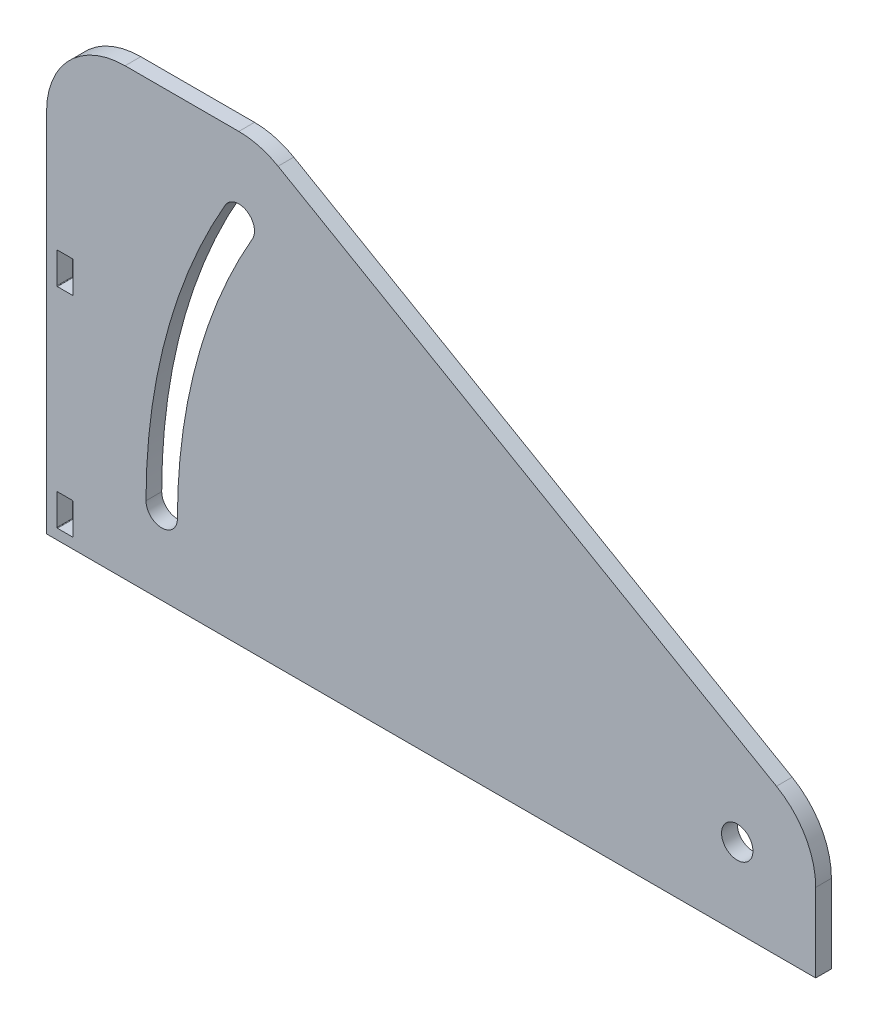
from build123d import *

# Parameters (mm, degrees)
SKETCH1_W           = 3.05
SKETCH1_H           = 6.05
SKETCH1_R           = 3
BOSS_EXTRUDE1_DEPTH = 3
FILLET1_R           = 15
FILLET2_R           = 0.1


with BuildPart() as part:
    # Sketch1 → Boss-Extrude1 (new body)
    with BuildSketch(Plane.XY):
        with BuildLine():
            Line((-32.74355653, 42.5), (-58.5, 42.5))
            ThreePointArc((-58.5, 42.5), (-69.106601718, 38.106601718), (-73.5, 27.5))
            Line((-73.5, 27.5), (-73.5, -42.5))
            Line((-73.5, -42.5), (73.5, -42.5))
            Line((73.5, -42.5), (73.5, -27.5))
            ThreePointArc((73.5, -27.5), (71.490381057, -20), (66, -14.509618943))
            Line((66, -14.509618943), (-32.74355653, 42.5))
        make_face()
        with BuildLine():
            ThreePointArc((-48.5, -27.5), (-51.500000015, -30.5), (-54.5, -27.499999969))
            ThreePointArc((-54.5, -27.499999969), (-50.649618339, 1.746552215), (-39.36087052, 29.000000186))
            ThreePointArc((-39.36087052, 29.000000186), (-35.262794319, 30.098076155), (-34.16471821, 25.999999992))
            ThreePointArc((-34.16471821, 25.999999992), (-44.854063414, 0.193637821), (-48.5, -27.5))
        make_face(mode=Mode.SUBTRACT)
        with Locations((-70, -37.5)):
            Rectangle(SKETCH1_W, SKETCH1_H, mode=Mode.SUBTRACT)
        with Locations((-70, 2.5)):
            Rectangle(SKETCH1_W, SKETCH1_H, mode=Mode.SUBTRACT)
        with Locations((58.5, -27.5)):
            Circle(SKETCH1_R, mode=Mode.SUBTRACT)
    extrude(amount=BOSS_EXTRUDE1_DEPTH)

    # Fillet1
    fillet1_edges = [part.edges().sort_by_distance(p)[0] for p in [
        (-32.74355653, 42.5, 1.5),
    ]]
    fillet(fillet1_edges, radius=FILLET1_R)

    # Fillet2
    fillet2_edges = [part.edges().sort_by_distance(p)[0] for p in [
        (-68.475, -0.525, 1.5),
        (-68.475, 5.525, 1.5),
        (-71.525, 5.525, 1.5),
        (-71.525, -0.525, 1.5),
        (-68.475, -34.475, 1.5),
        (-71.525, -34.475, 1.5),
        (-71.525, -40.525, 1.5),
        (-68.475, -40.525, 1.5),
    ]]
    fillet(fillet2_edges, radius=FILLET2_R)


solid = part.part
